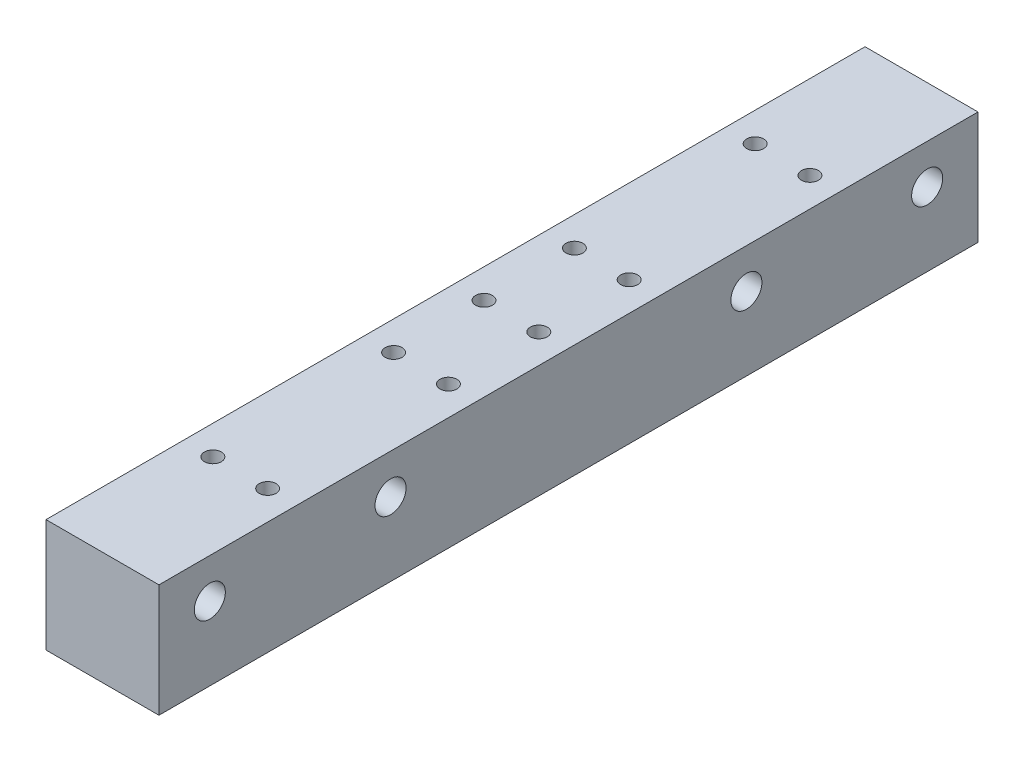
from build123d import *

# Parameters (mm, degrees)
SKETCH_1_W          = 20
SKETCH_1_H          = 20
EXTRUDE_1_DEPTH     = 145
SKETCH_2_R          = 2.75
CUT_EXTRUDE_1_DEPTH = 20
SKETCH_4_R          = 1.5
CUT_EXTRUDE_4_DEPTH = 20


with BuildPart() as part:
    # 草图1 → 凸台-拉伸1 (new body)
    with BuildSketch(Plane.XY):
        Rectangle(SKETCH_1_W, SKETCH_1_H)
    extrude(amount=EXTRUDE_1_DEPTH)

    # 草图2 → 切除-拉伸1 (cut)
    with BuildSketch(Plane(origin=(10, 0, 0), x_dir=(0, 0, -1), z_dir=(1, 0, 0))):
        with Locations((-136, 3)):
            Circle(SKETCH_2_R)
        with Locations((-104, 3)):
            Circle(SKETCH_2_R)
        with Locations((-9, 3)):
            Circle(SKETCH_2_R)
        with Locations((-41, 3)):
            Circle(SKETCH_2_R)
    extrude(amount=-CUT_EXTRUDE_1_DEPTH, mode=Mode.SUBTRACT)

    # 草图4 → 切除-拉伸4 (cut)
    with BuildSketch(Plane(origin=(0, 10, 0), x_dir=(1, 0, 0), z_dir=(0, 1, 0))):
        with Locations(Location((-4.85, -24.606973042, 0), (0, 0, 270))):
            Circle(SKETCH_4_R)
        with Locations(Location((-4.85, -56.606973042, 0), (0, 0, 270))):
            Circle(SKETCH_4_R)
        with Locations(Location((-4.85, -72.606973042, 0), (0, 0, 270))):
            Circle(SKETCH_4_R)
        with Locations(Location((-4.85, -88.606973042, 0), (0, 0, 270))):
            Circle(SKETCH_4_R)
        with Locations(Location((-4.85, -120.606973042, 0), (0, 0, 270))):
            Circle(SKETCH_4_R)
        with Locations(Location((4.85, -120.606973042, 0), (0, 0, 270))):
            Circle(SKETCH_4_R)
        with Locations(Location((4.85, -88.606973042, 0), (0, 0, 270))):
            Circle(SKETCH_4_R)
        with Locations(Location((4.85, -72.606973042, 0), (0, 0, 270))):
            Circle(SKETCH_4_R)
        with Locations(Location((4.85, -56.606973042, 0), (0, 0, 270))):
            Circle(SKETCH_4_R)
        with Locations(Location((4.85, -24.606973042, 0), (0, 0, 270))):
            Circle(SKETCH_4_R)
    extrude(amount=-CUT_EXTRUDE_4_DEPTH, mode=Mode.SUBTRACT)


solid = part.part
